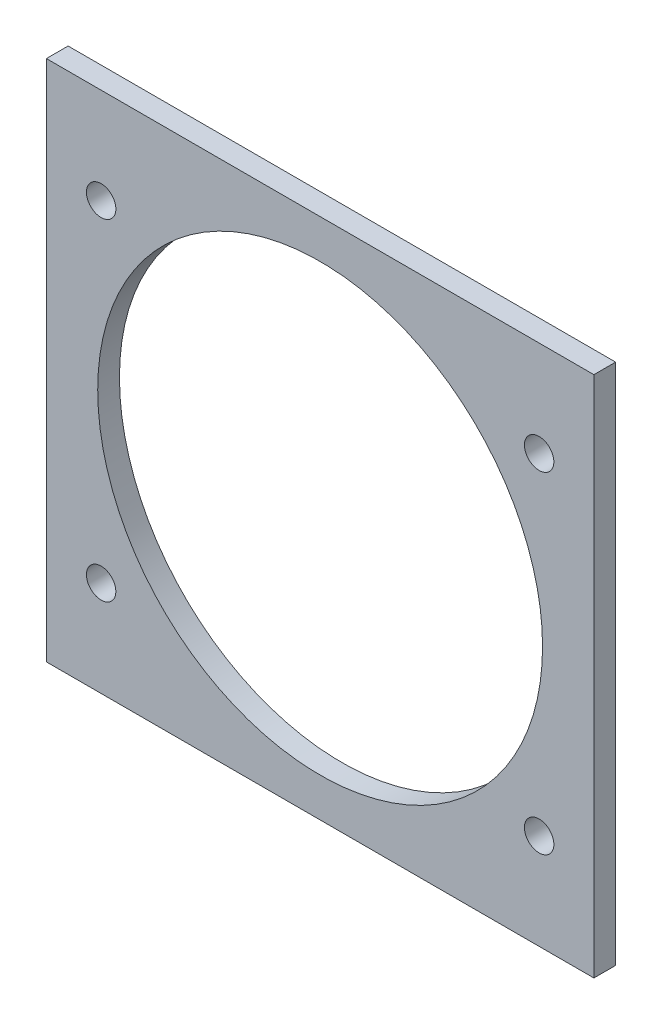
from build123d import *

# Parameters (mm, degrees)
SKETCH1_W           = 80
SKETCH1_H           = 76.35
SKETCH1_R           = 32.5
SKETCH1_R_2         = 2.15
BOSS_EXTRUDE1_DEPTH = 3.175


with BuildPart() as part:
    # Sketch1 → Boss-Extrude1 (new body)
    with BuildSketch(Plane.XY):
        Rectangle(SKETCH1_W, SKETCH1_H)
        Circle(SKETCH1_R, mode=Mode.SUBTRACT)
        with Locations((-32, 24.2)):
            Circle(SKETCH1_R_2, mode=Mode.SUBTRACT)
        with Locations(Location((-32, -24.2, 0), (0, 0, 180))):
            Circle(SKETCH1_R_2, mode=Mode.SUBTRACT)
        with Locations((32, -24.2)):
            Circle(SKETCH1_R_2, mode=Mode.SUBTRACT)
        with Locations(Location((32, 24.2, 0), (0, 0, 180))):
            Circle(SKETCH1_R_2, mode=Mode.SUBTRACT)
    extrude(amount=BOSS_EXTRUDE1_DEPTH)


solid = part.part
